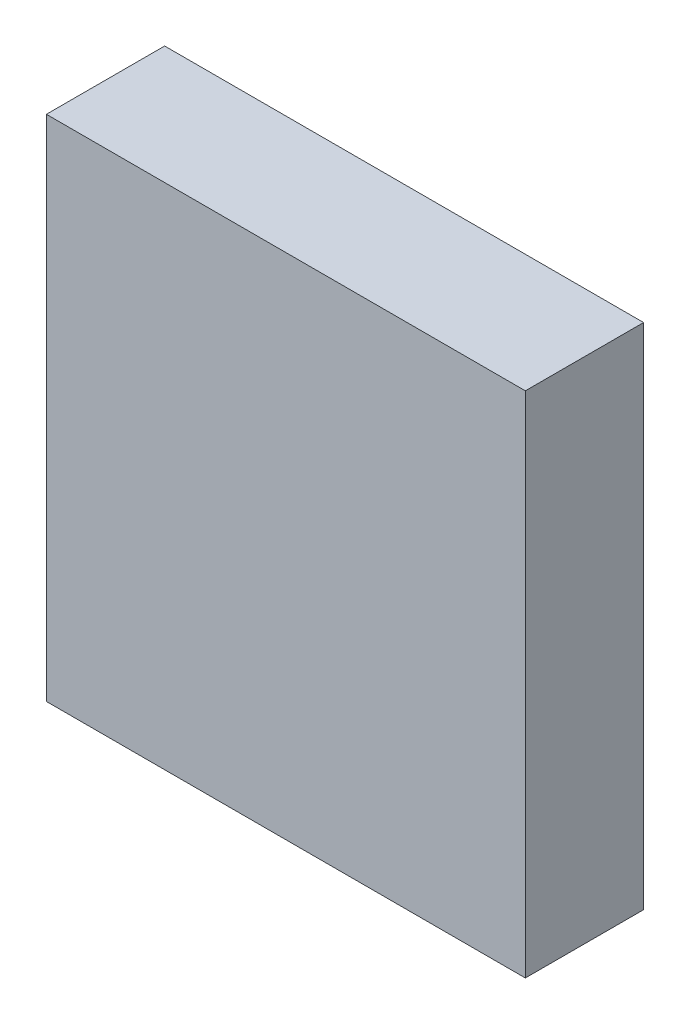
from build123d import *

# Parameters (mm, degrees)
SKETCH1_W           = 81
SKETCH1_H           = 86
BOSS_EXTRUDE1_DEPTH = 20


with BuildPart() as part:
    # Sketch1 → Boss-Extrude1 (new body)
    with BuildSketch(Plane.XY):
        Rectangle(SKETCH1_W, SKETCH1_H)
    extrude(amount=BOSS_EXTRUDE1_DEPTH)


solid = part.part
